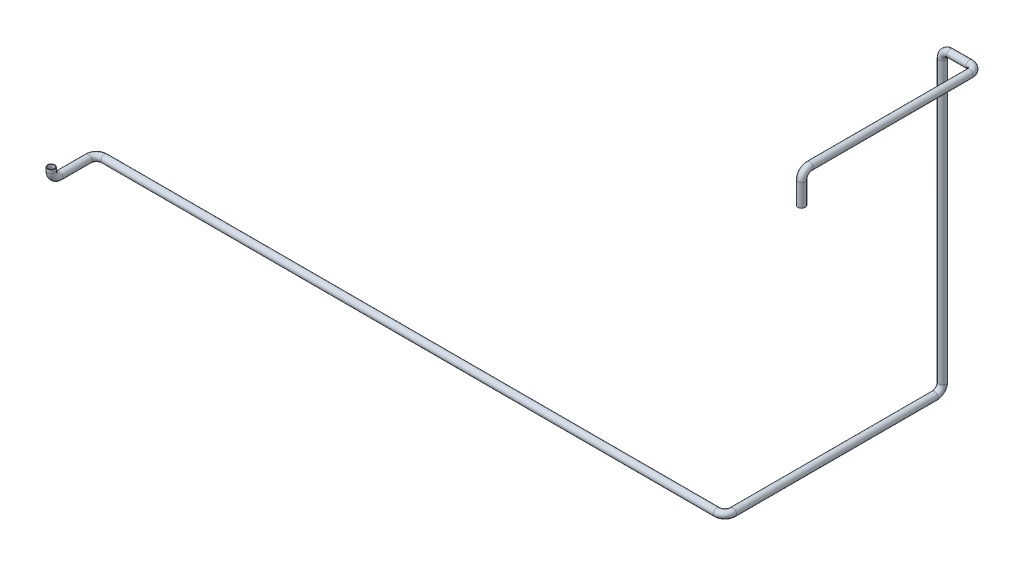
from build123d import *

# Parameters (mm, degrees)
CROQUIS1_R              = 14.5
CROQUIS1_R_2            = 12.7
SALIENTE_EXTRUIR1_DEPTH = 5
CROQUIS2_R              = 14.5
CROQUIS2_R_2            = 12.7


with BuildPart() as part:
    # Croquis1 → Saliente-Extruir1 (new body)
    with BuildSketch(Plane(origin=(0, 0, 0), x_dir=(1, 0, 0), z_dir=(0, 1, 0))):
        with Locations(Location((0, 0, 0), (0, 0, 270))):
            Circle(CROQUIS1_R)
        with Locations(Location((0, 0, 0), (0, 0, 270))):
            Circle(CROQUIS1_R_2, mode=Mode.SUBTRACT)
    extrude(amount=-SALIENTE_EXTRUIR1_DEPTH)

    # Barrer1: sweep along a curve in space
    with BuildLine() as barrer1_path:
        Line((0, -5, 0), (0, -13, 0))
        ThreePointArc((0, -13, 0), (0, -35.627416998, -9.372583002), (0, -45, -32))
        Line((0, -45, -32), (0, -45, -148))
        ThreePointArc((0, -45, -148), (9.372583002, -45, -170.627416998), (32, -45, -180))
        Line((32, -45, -180), (2468, -45, -180))
        ThreePointArc((2468, -45, -180), (2490.627416998, -45, -189.372583002), (2500, -45, -212))
        Line((2500, -45, -212), (2500, -45, -1013))
        ThreePointArc((2500, -45, -1013), (2500, -35.627416998, -1035.627416998), (2500, -13, -1045))
        Line((2500, -13, -1045), (2500, 1103, -1045))
        ThreePointArc((2500, 1103, -1045), (2509.372583002, 1125.627416998, -1045), (2532, 1135, -1045))
        Line((2532, 1135, -1045), (2608, 1135, -1045))
        ThreePointArc((2608, 1135, -1045), (2630.627416998, 1135, -1035.627416998), (2640, 1135, -1013))
        Line((2640, 1135, -1013), (2640, 1135, -377))
        ThreePointArc((2640, 1135, -377), (2640, 1125.627416998, -354.372583002), (2640, 1103, -345))
        Line((2640, 1103, -345), (2640, 1015, -345))
    # Croquis2 → Barrer1 (sweep)
    with BuildSketch(Plane.XZ.offset(5)):
        Circle(CROQUIS2_R)
        Circle(CROQUIS2_R_2, mode=Mode.SUBTRACT)
    sweep(path=barrer1_path.line)


solid = part.part
